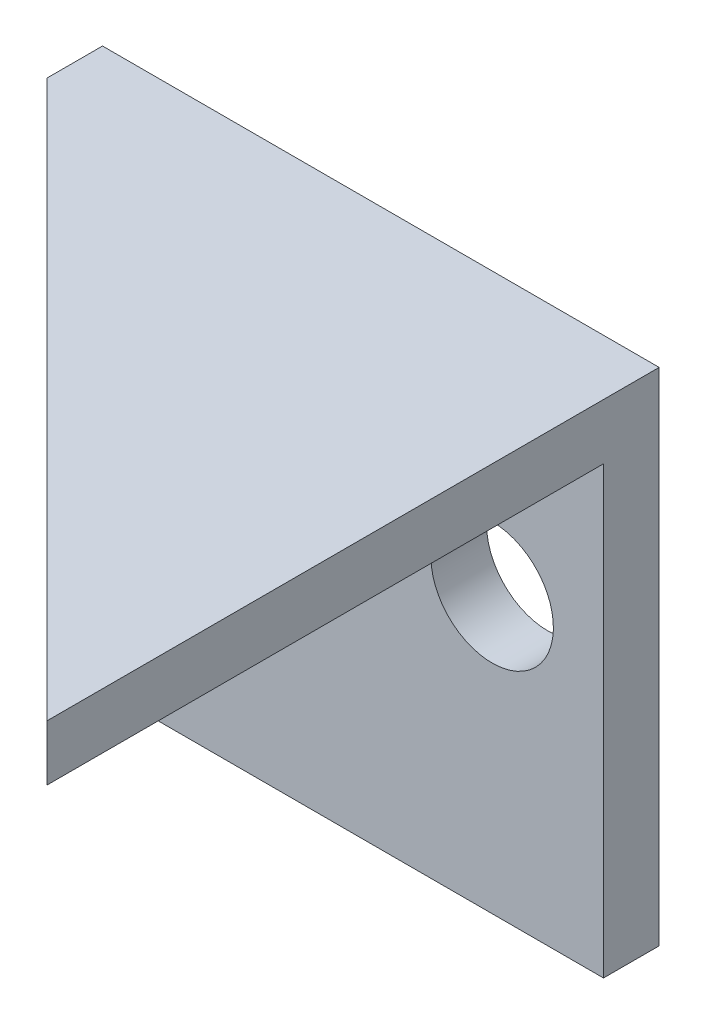
from build123d import *

# Parameters (mm, degrees)
BOSS_EXTRUDE1_DEPTH = 3
SKETCH2_W           = 30
SKETCH2_H           = 3
BOSS_EXTRUDE2_DEPTH = 24
SKETCH5_R           = 3.3
CUT_EXTRUDE1_DEPTH  = 10


with BuildPart() as part:
    # Sketch1 → Boss-Extrude1 (new body)
    with BuildSketch(Plane.XZ.offset(-12)):
        Polygon((15, 0), (15, 33), (-15, 3), (-15, 0), align=None)
    extrude(amount=-BOSS_EXTRUDE1_DEPTH)

    # Sketch2 → Boss-Extrude2 (add)
    with BuildSketch(Plane.XZ.offset(-12)):
        with Locations((0, 1.5)):
            Rectangle(SKETCH2_W, SKETCH2_H)
    extrude(amount=BOSS_EXTRUDE2_DEPTH)

    # Sketch5 → Cut-Extrude1 (cut)
    with BuildSketch(Plane(origin=(0, 0, 0), x_dir=(-1, 0, 0), z_dir=(0, 0, -1))):
        with Locations((-9, 3)):
            Circle(SKETCH5_R)
        with Locations((9, 3)):
            Circle(SKETCH5_R)
    extrude(amount=-CUT_EXTRUDE1_DEPTH, mode=Mode.SUBTRACT)


solid = part.part
